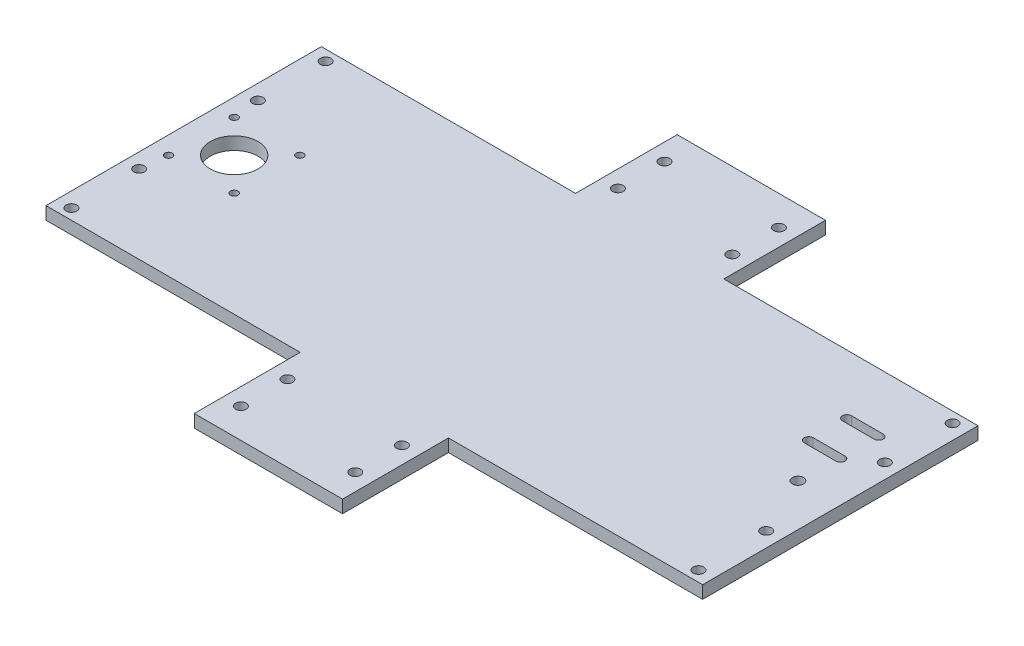
from build123d import *

# Parameters (mm, degrees)
CROQUIS1_R              = 1.75
CROQUIS1_R_2            = 11.25
CROQUIS1_R_3            = 2.65
CROQUIS1_R_4            = 2.5
SALIENTE_EXTRUIR1_DEPTH = 6
CORTAR_EXTRUIR1_DEPTH   = 194.095831131


with BuildPart() as part:
    # Croquis1 → Saliente-Extruir1 (new body)
    with BuildSketch(Plane(origin=(0, 0, 0), x_dir=(1, 0, 0), z_dir=(0, 1, 0))):
        Polygon((-155, -65), (-43.397871348, -65), (-35, -65), (-35, -71), (-35, -109), (-35, -115), (-29, -115), (29, -115), (35, -115), (35, -109), (35, -71), (35, -65), (51, -65), (155, -65), (155, 65), (51, 65), (35, 65), (35, 71), (35, 107), (35, 113), (29, 113), (-29, 113), (-35, 113), (-35, 107), (-35, 71), (-35, 65), (-43.397871348, 65), (-155, 65), align=None)
        with Locations(Location((-146.655, 15.495, 0), (0, 0, 270))):
            Circle(CROQUIS1_R, mode=Mode.SUBTRACT)
        with Locations(Location((-115.665, 15.495, 0), (0, 0, 270))):
            Circle(CROQUIS1_R, mode=Mode.SUBTRACT)
        with Locations(Location((-115.665, -15.495, 0), (0, 0, 270))):
            Circle(CROQUIS1_R, mode=Mode.SUBTRACT)
        with Locations(Location((-146.655, -15.495, 0), (0, 0, 270))):
            Circle(CROQUIS1_R, mode=Mode.SUBTRACT)
        with Locations(Location((-131.16, 0, 0), (0, 0, 270))):
            Circle(CROQUIS1_R_2, mode=Mode.SUBTRACT)
        with Locations(Location((135, 0, 0), (0, 0, 270))):
            Circle(CROQUIS1_R_3, mode=Mode.SUBTRACT)
        with Locations(Location((-148, -60, 0), (0, 0, 270))):
            Circle(CROQUIS1_R_4, mode=Mode.SUBTRACT)
        with Locations(Location((-148, -28, 0), (0, 0, 270))):
            Circle(CROQUIS1_R_4, mode=Mode.SUBTRACT)
        with Locations(Location((148, -60, 0), (0, 0, 270))):
            Circle(CROQUIS1_R_4, mode=Mode.SUBTRACT)
        with Locations(Location((148, -28, 0), (0, 0, 270))):
            Circle(CROQUIS1_R_4, mode=Mode.SUBTRACT)
        with Locations(Location((148, 60, 0), (0, 0, 90))):
            Circle(CROQUIS1_R_4, mode=Mode.SUBTRACT)
        with Locations(Location((148, 28, 0), (0, 0, 90))):
            Circle(CROQUIS1_R_4, mode=Mode.SUBTRACT)
        with Locations(Location((-148, 60, 0), (0, 0, 90))):
            Circle(CROQUIS1_R_4, mode=Mode.SUBTRACT)
        with Locations(Location((-148, 28, 0), (0, 0, 90))):
            Circle(CROQUIS1_R_4, mode=Mode.SUBTRACT)
        with Locations(Location((-27, 99, 0), (0, 0, 270))):
            Circle(CROQUIS1_R_4, mode=Mode.SUBTRACT)
        with Locations(Location((-27, 77, 0), (0, 0, 270))):
            Circle(CROQUIS1_R_4, mode=Mode.SUBTRACT)
        with Locations(Location((27, 77, 0), (0, 0, 90))):
            Circle(CROQUIS1_R_4, mode=Mode.SUBTRACT)
        with Locations(Location((27, 99, 0), (0, 0, 90))):
            Circle(CROQUIS1_R_4, mode=Mode.SUBTRACT)
        with Locations(Location((27, -101, 0), (0, 0, 270))):
            Circle(CROQUIS1_R_4, mode=Mode.SUBTRACT)
        with Locations(Location((27, -79, 0), (0, 0, 270))):
            Circle(CROQUIS1_R_4, mode=Mode.SUBTRACT)
        with Locations(Location((-27, -101, 0), (0, 0, 90))):
            Circle(CROQUIS1_R_4, mode=Mode.SUBTRACT)
        with Locations(Location((-27, -79, 0), (0, 0, 90))):
            Circle(CROQUIS1_R_4, mode=Mode.SUBTRACT)
    extrude(amount=SALIENTE_EXTRUIR1_DEPTH)

    # Croquis3 → Cortar-Extruir1 (cut, through all)
    with BuildSketch(Plane(origin=(0, 6, 0), x_dir=(1, 0, 0), z_dir=(0, 1, 0))):
        with BuildLine():
            Line((136, 35), (121, 35))
            ThreePointArc((121, 35), (118.9, 37.1), (121, 39.2))
            Line((121, 39.2), (136, 39.2))
            ThreePointArc((136, 39.2), (138.1, 37.1), (136, 35))
        make_face()
        with BuildLine():
            Line((136, 21.2), (121, 21.2))
            ThreePointArc((121, 21.2), (118.9, 19.1), (121, 17))
            Line((121, 17), (136, 17))
            ThreePointArc((136, 17), (138.1, 19.1), (136, 21.2))
        make_face()
    extrude(amount=-CORTAR_EXTRUIR1_DEPTH, mode=Mode.SUBTRACT)


solid = part.part
